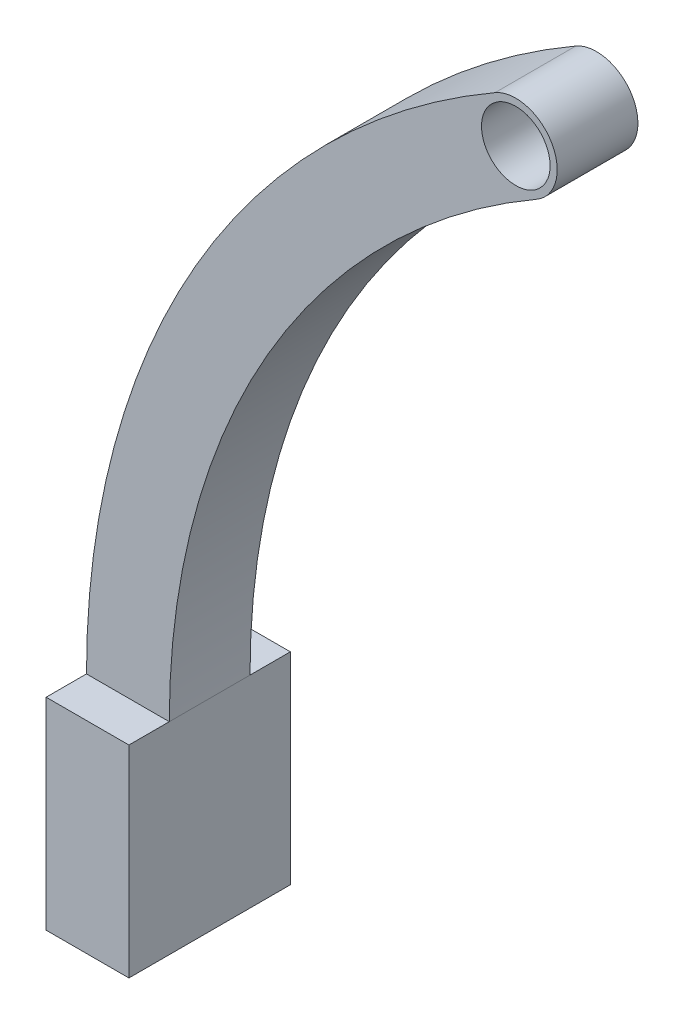
from build123d import *

# Parameters (mm, degrees)
SKETCH_1_R           = 17
EXTRUDE_1_DEPTH      = 40
EXTRUDE_2_DEPTH      = 60
EXTRUDE_2_DEPTH_BACK = 20
SKETCH_2_W           = 41.02774957
SKETCH_2_H           = 100


with BuildPart() as part:
    # 草图1 → 凸台-拉伸1 (new body)
    with BuildSketch(Plane.XY):
        with BuildLine():
            ThreePointArc((-181.986125215, 315.209215145), (-315.209215145, 181.986125215), (-363.97225043, 0))
            Line((-363.97225043, 0), (-405, 0))
            ThreePointArc((-405, 0), (-350.740288533, 202.5), (-202.5, 350.740288533))
            ThreePointArc((-202.5, 350.740288533), (-174.477525913, 343.231689231), (-181.986125215, 315.209215145))
        make_face()
        with Locations((-192.243062607, 332.974751839)):
            Circle(SKETCH_1_R, mode=Mode.SUBTRACT)
    extrude(amount=EXTRUDE_1_DEPTH)

    # 草图2 → 凸台-拉伸2 (add, two sides: drawn at the far end of the back side and taken through both)
    with BuildSketch(Plane.XY.offset(-EXTRUDE_2_DEPTH_BACK)):
        with Locations((-384.486125215, -50)):
            Rectangle(SKETCH_2_W, SKETCH_2_H)
    extrude(amount=EXTRUDE_2_DEPTH + EXTRUDE_2_DEPTH_BACK)


solid = part.part
